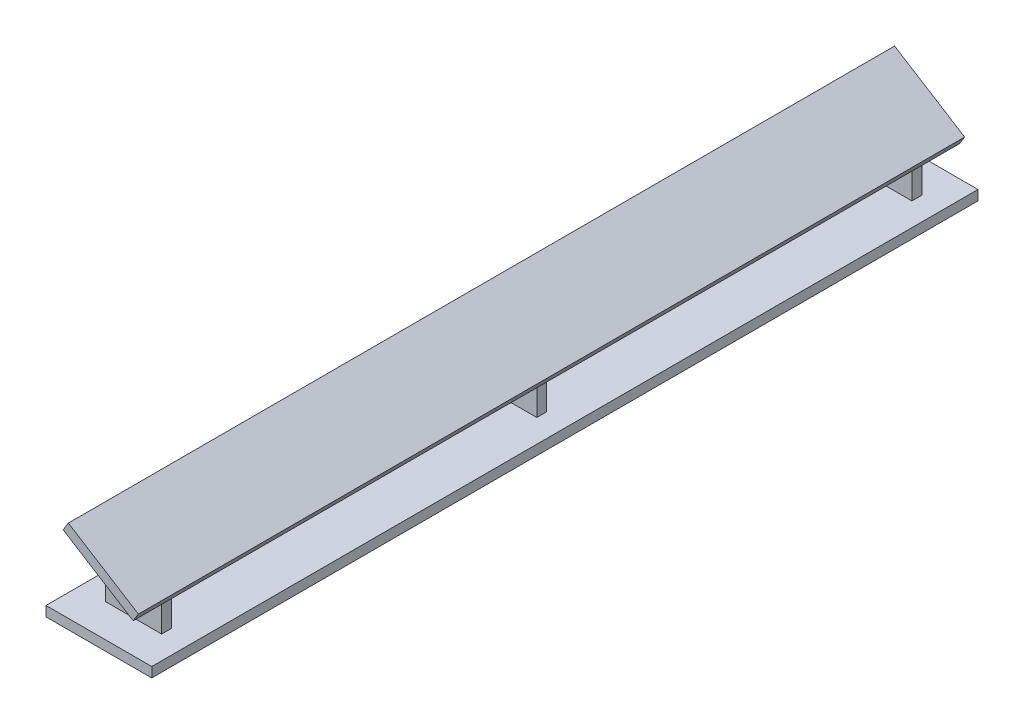
from build123d import *

# Parameters (mm, degrees)
SKETCH_1_W                      = 64
SKETCH_1_H                      = 6
BASE_PLATE_940_TO_1004_T6_DEPTH = 500
INCLINED_BEARING_PLATE_T6_DEPTH = 500
TOE_WEB_1_T6_START              = 20
TOE_WEB_1_T6_DEPTH              = 6
TOE_WEB_2_T6_START              = 247
TOE_WEB_2_T6_DEPTH              = 6
TOE_WEB_3_T6_START              = 474
TOE_WEB_3_T6_DEPTH              = 6


with BuildPart() as part:
    # 草图1 → Base_plate_940_to_1004_t6 (new body)
    with BuildSketch(Plane.XY):
        with Locations((972, 3)):
            Rectangle(SKETCH_1_W, SKETCH_1_H)
    extrude(amount=BASE_PLATE_940_TO_1004_T6_DEPTH)



with BuildPart() as body_2:
    # 草图2 → Inclined_bearing_plate_t6 (new body)
    with BuildSketch(Plane.XY):
        Polygon((953.526014292, 55.936634693), (995.928419099, 29.440671481), (992.748903514, 24.352382904), (950.346498706, 50.848346116), align=None)
    extrude(amount=INCLINED_BEARING_PLATE_T6_DEPTH)


with BuildPart() as part_1:
    add(part.part)

    add(body_2.part)  # Toe_web_1_t6 merges body 2
    # 草图3 → Toe_web_1_t6 (add)
    with BuildSketch(Plane.XY.offset(TOE_WEB_1_T6_START)):
        Polygon((956, 6), (990, 6), (990, 26.070088461), (956, 47.315646426), align=None)
    extrude(amount=TOE_WEB_1_T6_DEPTH)

    # 草图4 → Toe_web_2_t6 (add)
    with BuildSketch(Plane.XY.offset(TOE_WEB_2_T6_START)):
        Polygon((956, 6), (990, 6), (990, 26.070088461), (956, 47.315646426), align=None)
    extrude(amount=TOE_WEB_2_T6_DEPTH)

    # 草图5 → Toe_web_3_t6 (add)
    with BuildSketch(Plane.XY.offset(TOE_WEB_3_T6_START)):
        Polygon((956, 6), (990, 6), (990, 26.070088461), (956, 47.315646426), align=None)
    extrude(amount=TOE_WEB_3_T6_DEPTH)


solid = part_1.part
